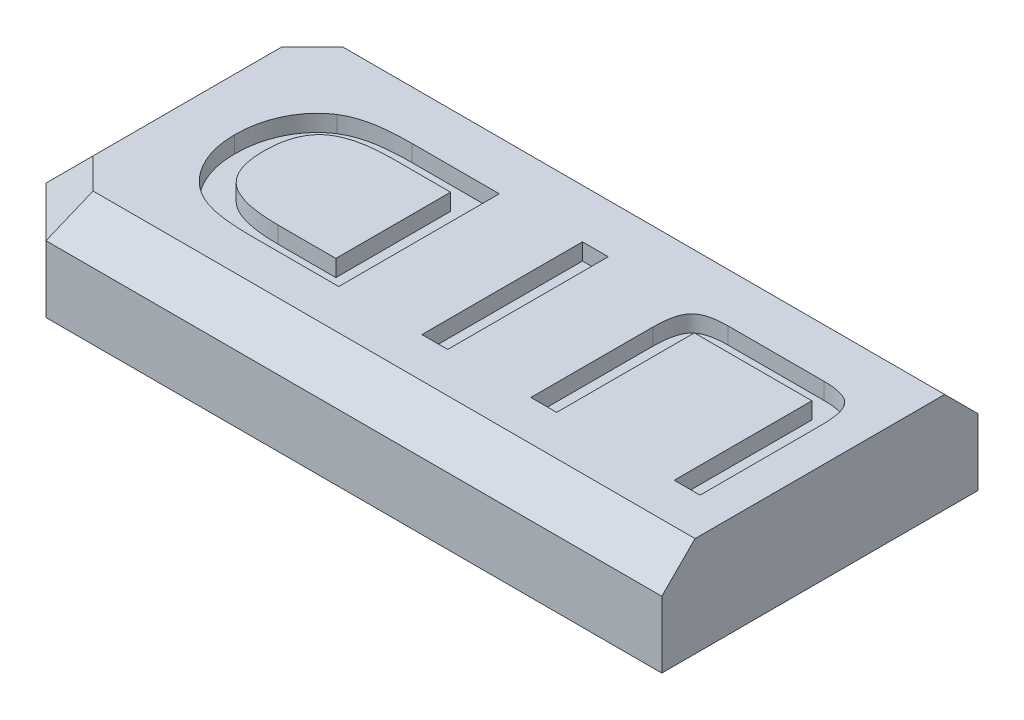
from build123d import *

# Parameters (mm, degrees)
BOSS_EXTRUDE1_DEPTH = 6
SKETCH2_W           = 1.55073591
SKETCH2_H           = 9.649023438
SKETCH2_W_2         = 1.550735909
CUT_EXTRUDE1_DEPTH  = 1
SKETCH3_W           = 49.814071519
SKETCH3_H           = 34.699545546
CUT_EXTRUDE2_DEPTH  = 10
CHAMFER1_SIZE       = 3
CHAMFER2_SIZE       = 2
SKETCH4_R           = 4.1
CUT_EXTRUDE3_DEPTH  = 3.4


with BuildPart() as part:
    # Sketch1 → Boss-Extrude1 (new body)
    with BuildSketch(Plane(origin=(0, -196.798939869, 0), x_dir=(1, 0, 0), z_dir=(0, 1, 0))):
        Polygon((-110.695481055, -390.620141885), (-70.695481055, -390.620141885), (-70.695481055, -409.620141885), (-110.695481055, -409.620141885), (-151.695481055, -409.620141885), (-151.695481055, -390.620141885), align=None)
    extrude(amount=BOSS_EXTRUDE1_DEPTH)

    # Sketch2 → Cut-Extrude1 (cut)
    # profile 1 of 6: a face of its own
    with BuildSketch(Plane(origin=(0, -190.798939869, 0), x_dir=(1, 0, 0), z_dir=(0, 1, 0))):
        with BuildLine():
            add(Edge.make_bspline(
                [(-140.767176982, -405.209924667), (-140.982622928, -405.208412821), (-141.394982016, -405.205519181), (-141.98403336, -405.168701103), (-142.517358029, -405.117955452), (-142.996891336, -405.040429638), (-143.431861328, -404.937751856), (-143.828275274, -404.808826708), (-144.192604534, -404.655107583), (-144.412843494, -404.524922655), (-144.520173264, -404.46147921)],
                knots=[0, 0, 0, 0, 1.333778163, 2.552823848, 3.653108193, 4.649746513, 5.558133507, 6.417402386, 7.228747549, 8, 8, 8, 8], degree=3))
            add(Edge.make_bspline(
                [(-144.520173264, -404.46147921), (-144.672688651, -404.354540566), (-144.977706991, -404.140671998), (-145.372980808, -403.740179693), (-145.72204175, -403.288685781), (-146.015251375, -402.783895607), (-146.252341242, -402.23844628), (-146.422101614, -401.66260039), (-146.524137936, -401.061196848), (-146.537803169, -400.652341907), (-146.544745145, -400.444642444)],
                knots=[0, 0, 0, 0, 0.952297785, 1.904517931, 2.867930349, 3.869019748, 4.885904814, 5.906780791, 6.936638737, 8, 8, 8, 8], degree=3))
            add(Edge.make_bspline(
                [(-146.544745145, -400.444642444), (-146.539017026, -400.224388593), (-146.527802756, -399.793184944), (-146.425839385, -399.164163809), (-146.258098069, -398.569953885), (-146.027848138, -398.012133469), (-145.734933397, -397.499500284), (-145.384408604, -397.041985203), (-144.985328734, -396.634035669), (-144.675593052, -396.417833194), (-144.520173264, -396.309346685)],
                knots=[0, 0, 0, 0, 1.100129358, 2.153786604, 3.174592563, 4.179911314, 5.162319574, 6.115853573, 7.05456925, 8, 8, 8, 8], degree=3))
            add(Edge.make_bspline(
                [(-144.520173264, -396.309346685), (-144.415407214, -396.247970567), (-144.198209286, -396.120727383), (-143.840423238, -395.967019912), (-143.444768852, -395.841274433), (-143.011380567, -395.735735637), (-142.529145335, -395.655193263), (-141.993148894, -395.601522013), (-141.399450617, -395.565451573), (-140.984411915, -395.562464625), (-140.767176982, -395.560901229)],
                knots=[0, 0, 0, 0, 0.751413761, 1.557809164, 2.404944974, 3.320203742, 4.317937033, 5.430050062, 6.654865437, 8, 8, 8, 8], degree=3))
            Line((-140.767176982, -395.560901229), (-135.517289788, -395.560901229))
            Line((-135.517289788, -395.560901229), (-135.517289788, -405.209924667))
            Line((-135.517289788, -405.209924667), (-140.767176982, -405.209924667))
        make_face()
        with BuildLine():
            Line((-140.538335746, -403.831492747), (-137.068025698, -403.831492747))
            Line((-137.068025698, -403.831492747), (-137.068025698, -396.939333149))
            Line((-137.068025698, -396.939333149), (-140.538335746, -396.939333149))
            add(Edge.make_bspline(
                [(-140.538335746, -396.939333149), (-140.726862755, -396.941898287), (-141.089956251, -396.946838613), (-141.61301485, -396.984845883), (-142.093527417, -397.044798091), (-142.531495923, -397.132160177), (-142.925368528, -397.248552244), (-143.278930228, -397.383732816), (-143.589154837, -397.547989389), (-143.856977936, -397.741453756), (-144.088661152, -397.964049484), (-144.285418794, -398.219866085), (-144.453911174, -398.507093156), (-144.587443165, -398.829479607), (-144.695661065, -399.182540893), (-144.769772109, -399.569730192), (-144.811875271, -399.989610443), (-144.818346787, -400.28031641), (-144.821705246, -400.431181195)],
                knots=[0, 0, 0, 0, 1.40931624, 2.714271877, 3.918424909, 5.027624621, 6.048757475, 6.985660279, 7.853111911, 8.665027323, 9.447928266, 10.246427284, 11.070312611, 11.930128696, 12.849083366, 13.826707191, 14.872147839, 16, 16, 16, 16], degree=3))
            add(Edge.make_bspline(
                [(-144.821705246, -400.431181195), (-144.818709771, -400.576712398), (-144.812924864, -400.857764438), (-144.765683368, -401.263673078), (-144.694488189, -401.639383199), (-144.580929863, -401.980833169), (-144.445105089, -402.294186016), (-144.27545686, -402.57538752), (-144.073112413, -402.824282209), (-143.83895635, -403.042456395), (-143.566561363, -403.230826533), (-143.2546296, -403.391353977), (-142.901690894, -403.528470783), (-142.507862117, -403.640795062), (-142.072601063, -403.725173206), (-141.597799376, -403.786080538), (-141.081882008, -403.823960231), (-140.724169188, -403.828917449), (-140.538335746, -403.831492747)],
                knots=[0, 0, 0, 0, 1.1029475, 2.130028734, 3.094733, 3.996236287, 4.852145578, 5.679426148, 6.477428238, 7.276560664, 8.097578654, 8.980088779, 9.930191586, 10.963809582, 12.080624623, 13.288249086, 14.591233026, 16, 16, 16, 16], degree=3))
        make_face(mode=Mode.SUBTRACT)
    # profile 2 of 6: a face of its own
    with BuildSketch(Plane(origin=(0, -190.798939869, 0), x_dir=(1, 0, 0), z_dir=(0, 1, 0))):
        with Locations((-129.745106125, -400.385412948)):
            Rectangle(SKETCH2_W, SKETCH2_H)
    # profile 3 of 6: a face of its own
    with BuildSketch(Plane(origin=(0, -190.798939869, 0), x_dir=(1, 0, 0), z_dir=(0, 1, 0))):
        with BuildLine():
            Line((-115.357722964, -405.209924667), (-115.357722964, -396.939333149))
            Line((-115.357722964, -396.939333149), (-122.422186552, -396.939333149))
            Line((-122.422186552, -396.939333149), (-122.422186552, -405.209924667))
            Line((-122.422186552, -405.209924667), (-123.972922461, -405.209924667))
            Line((-123.972922461, -405.209924667), (-123.972922461, -397.876236094))
            add(Edge.make_bspline(
                [(-123.972922461, -397.876236094), (-123.97130062, -397.768503726), (-123.968175155, -397.560891645), (-123.946562754, -397.263453332), (-123.913361153, -396.992319774), (-123.861781613, -396.749497692), (-123.798905063, -396.532206755), (-123.717930323, -396.342601202), (-123.623893906, -396.179127334), (-123.51405496, -396.039134081), (-123.380645379, -395.924069451), (-123.223997755, -395.826555258), (-123.043098505, -395.743432714), (-122.835801675, -395.677092248), (-122.603622791, -395.623157153), (-122.345091238, -395.586720416), (-122.061773796, -395.565800066), (-121.864927889, -395.56257696), (-121.76258534, -395.560901229)],
                knots=[0, 0, 0, 0, 1.365025829, 2.630554399, 3.777289411, 4.823296905, 5.773086012, 6.639126, 7.429026898, 8.157168554, 8.882463115, 9.649102086, 10.488604984, 11.398409027, 12.402469484, 13.50569655, 14.703181711, 16, 16, 16, 16], degree=3))
            Line((-121.76258534, -395.560901229), (-116.009247426, -395.560901229))
            add(Edge.make_bspline(
                [(-116.009247426, -395.560901229), (-115.906920359, -395.562687865), (-115.710104231, -395.566124284), (-115.427333413, -395.58552546), (-115.171085642, -395.626525893), (-114.940696482, -395.680226348), (-114.733396449, -395.745508539), (-114.553275043, -395.832261863), (-114.396325587, -395.931154528), (-114.266726678, -396.050908492), (-114.154943277, -396.190042043), (-114.062808079, -396.355700348), (-113.981390872, -396.544829811), (-113.917656822, -396.761041229), (-113.866888225, -397.002247145), (-113.833414163, -397.270620412), (-113.811650677, -397.564474201), (-113.808585204, -397.769400211), (-113.806987054, -397.876236094)],
                knots=[0, 0, 0, 0, 1.301446602, 2.503205558, 3.60080036, 4.597332017, 5.510383128, 6.357737689, 7.133266863, 7.860254787, 8.590995162, 9.393593455, 10.262724318, 11.204977956, 12.254718625, 13.394230236, 14.64151108, 16, 16, 16, 16], degree=3))
            Line((-113.806987054, -397.876236094), (-113.806987054, -405.209924667))
            Line((-113.806987054, -405.209924667), (-115.357722964, -405.209924667))
        make_face()
    # profile 4 of 6: a face of its own
    with BuildSketch(Plane(origin=(0, -190.798939869, 0), x_dir=(1, 0, 0), z_dir=(0, 1, 0))):
        with BuildLine():
            add(Edge.make_bspline(
                [(-97.955019978, -402.870359553), (-97.956652565, -402.978088999), (-97.959798739, -403.185695451), (-97.981268964, -403.483172415), (-98.015048775, -403.755050365), (-98.065378023, -403.999133459), (-98.1304323, -404.217037438), (-98.206687836, -404.40992551), (-98.301548404, -404.575336569), (-98.411034046, -404.718120224), (-98.544442988, -404.835934988), (-98.701069946, -404.936199437), (-98.882708774, -405.022503111), (-99.090920415, -405.091152386), (-99.324340246, -405.145039922), (-99.583864206, -405.180769412), (-99.869613361, -405.206059906), (-100.069270672, -405.208599655), (-100.173433849, -405.209924667)],
                knots=[0, 0, 0, 0, 1.356221993, 2.613588442, 3.7529275, 4.803245948, 5.746909319, 6.613424892, 7.408010909, 8.14031288, 8.868419245, 9.636206373, 10.47510186, 11.393329314, 12.390914008, 13.487025728, 14.688956683, 16, 16, 16, 16], degree=3))
            Line((-100.173433849, -405.209924667), (-106.936365454, -405.209924667))
            add(Edge.make_bspline(
                [(-106.936365454, -405.209924667), (-107.03959143, -405.208168009), (-107.237308227, -405.204803345), (-107.521846366, -405.185117085), (-107.779867844, -405.144247356), (-108.01302586, -405.090709797), (-108.221545349, -405.025218465), (-108.404305019, -404.941105061), (-108.562292124, -404.842079279), (-108.695959314, -404.723411798), (-108.805834581, -404.580848257), (-108.899064948, -404.415265905), (-108.981397593, -404.224482592), (-109.043478168, -404.005085856), (-109.09525377, -403.759657576), (-109.128239011, -403.486707323), (-109.150133277, -403.187505345), (-109.153187914, -402.978991502), (-109.154779325, -402.870359553)],
                knots=[0, 0, 0, 0, 1.299210286, 2.488479226, 3.585823455, 4.582994824, 5.497291421, 6.331034297, 7.108000517, 7.835805208, 8.567803767, 9.362060566, 10.222158455, 11.176253704, 12.226136976, 13.376204297, 14.633049786, 16, 16, 16, 16], degree=3))
            Line((-109.154779325, -402.870359553), (-109.154779325, -397.854698095))
            add(Edge.make_bspline(
                [(-109.154779325, -397.854698095), (-109.153151378, -397.747864039), (-109.150015111, -397.542046438), (-109.128503265, -397.247278496), (-109.094894709, -396.978008156), (-109.044020497, -396.736842057), (-108.980901322, -396.521291491), (-108.899001076, -396.334013033), (-108.80658263, -396.171325929), (-108.69573208, -396.033634198), (-108.561285836, -395.920666277), (-108.403637682, -395.824563938), (-108.221581059, -395.740232658), (-108.01335545, -395.674186162), (-107.77970286, -395.624053469), (-107.52162289, -395.586441232), (-107.237333904, -395.5658101), (-107.039600238, -395.562585014), (-106.936365454, -395.560901229)],
                knots=[0, 0, 0, 0, 1.357245466, 2.61475614, 3.753224731, 4.80200455, 5.743395722, 6.6012629, 7.393257341, 8.114460715, 8.834220599, 9.61255537, 10.454283276, 11.377336392, 12.381536746, 13.487687791, 14.68834675, 16, 16, 16, 16], degree=3))
            Line((-106.936365454, -395.560901229), (-105.81908177, -395.560901229))
            Line((-105.81908177, -395.560901229), (-106.974056952, -393.14864537))
            Line((-106.974056952, -393.14864537), (-105.420628793, -393.14864537))
            Line((-105.420628793, -393.14864537), (-104.384112603, -395.560901229))
            Line((-104.384112603, -395.560901229), (-100.173433849, -395.560901229))
            add(Edge.make_bspline(
                [(-100.173433849, -395.560901229), (-100.069299861, -395.562576695), (-99.869770228, -395.565787032), (-99.583710784, -395.586483719), (-99.324398952, -395.623381546), (-99.090777766, -395.67665049), (-98.883528866, -395.746452514), (-98.700271675, -395.828557698), (-98.545451596, -395.929855275), (-98.410938513, -396.044261005), (-98.302420462, -396.184244467), (-98.205884472, -396.345061043), (-98.130494516, -396.534972277), (-98.066128283, -396.748472614), (-98.014313393, -396.98778752), (-97.981722229, -397.253596433), (-97.959616393, -397.545617805), (-97.95659546, -397.74875672), (-97.955019978, -397.854698095)],
                knots=[0, 0, 0, 0, 1.324586597, 2.538021266, 3.64545599, 4.653345889, 5.581058773, 6.423763498, 7.199481985, 7.927542786, 8.658461541, 9.441536144, 10.306446208, 11.248929857, 12.276599877, 13.416389652, 14.652590838, 16, 16, 16, 16], degree=3))
            Line((-97.955019978, -397.854698095), (-97.955019978, -402.870359553))
        make_face()
        Polygon((-105.178326307, -396.939333149), (-107.604043416, -396.939333149), (-107.604043416, -403.831492747), (-99.505755888, -403.831492747), (-99.505755888, -396.939333149), (-103.75412614, -396.939333149), (-102.744532449, -399.106594272), (-103.845662635, -399.523892998), align=None, mode=Mode.SUBTRACT)
    # profile 5 of 6: a face of its own
    with BuildSketch(Plane(origin=(0, -190.798939869, 0), x_dir=(1, 0, 0), z_dir=(0, 1, 0))):
        with Locations((-92.182836315, -400.385412948)):
            Rectangle(SKETCH2_W_2, SKETCH2_H)
    # profile 6 of 6: a face of its own
    with BuildSketch(Plane(origin=(0, -190.798939869, 0), x_dir=(1, 0, 0), z_dir=(0, 1, 0))):
        Polygon((-79.173885073, -395.560901229), (-79.173885073, -405.209924667), (-80.724620983, -405.209924667), (-80.724620983, -396.939333149), (-87.961388561, -396.939333149), (-87.961388561, -395.560901229), align=None)
    extrude(amount=-CUT_EXTRUDE1_DEPTH, mode=Mode.SUBTRACT)

    # Sketch3 → Cut-Extrude2 (cut)
    with BuildSketch(Plane(origin=(0, -190.798939869, 0), x_dir=(1, 0, 0), z_dir=(0, 1, 0))):
        with Locations((-86.788445295, -401.485593686)):
            Rectangle(SKETCH3_W, SKETCH3_H)
    extrude(amount=-CUT_EXTRUDE2_DEPTH, mode=Mode.SUBTRACT)

    # Chamfer1
    chamfer1_edges = [part.edges().sort_by_distance(p)[0] for p in [
        (-151.695481055, -193.798939869, 409.620141885),
        (-151.695481055, -193.798939869, 390.620141885),
    ]]
    chamfer(chamfer1_edges, length=CHAMFER1_SIZE)

    # Chamfer2
    chamfer2_edges = [part.edges().sort_by_distance(p)[0] for p in [
        (-130.195481055, -190.798939869, 390.620141885),
        (-130.195481055, -190.798939869, 409.620141885),
        (-151.695481055, -190.798939869, 400.120141885),
        (-150.195481055, -190.798939869, 392.120141885),
        (-150.195481055, -190.798939869, 408.120141885),
    ]]
    chamfer(chamfer2_edges, length=CHAMFER2_SIZE)

    # Sketch4 → Cut-Extrude3 (cut)
    with BuildSketch(Plane.XZ.offset(196.798939869)):
        with Locations(Location((-131.195481055, 400.120141885, 0), (0, 0, 270))):
            Circle(SKETCH4_R)
    extrude(amount=-CUT_EXTRUDE3_DEPTH, mode=Mode.SUBTRACT)


solid = part.part
